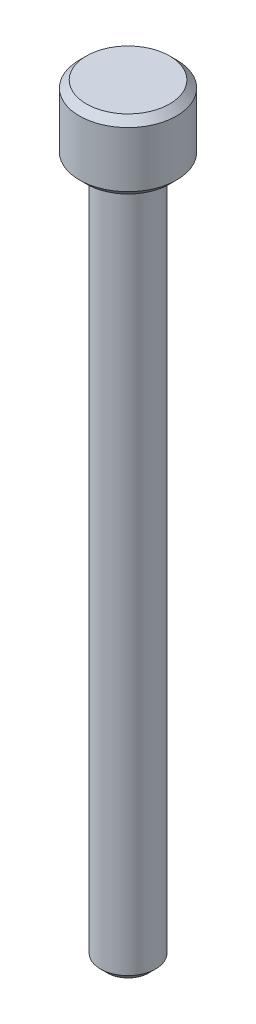
from build123d import *


with BuildPart() as part:
    # Sketch1 → Revolve1 (revolve)
    with BuildSketch(Plane.XY, mode=Mode.PRIVATE) as revolve1_sk:
        Polygon((3.96875, 99), (3.96875, 1), (2.96875, 0), (0, 0), (0, 110), (6, 110), (7, 109), (7, 101), (6, 100), (4.96875, 100), align=None)
    revolve(revolve1_sk.sketch.rotate(Axis((0, 0, 0), (0, 1, 0)), 90), axis=Axis((0, 0, 0), (0, 1, 0)))


solid = part.part
